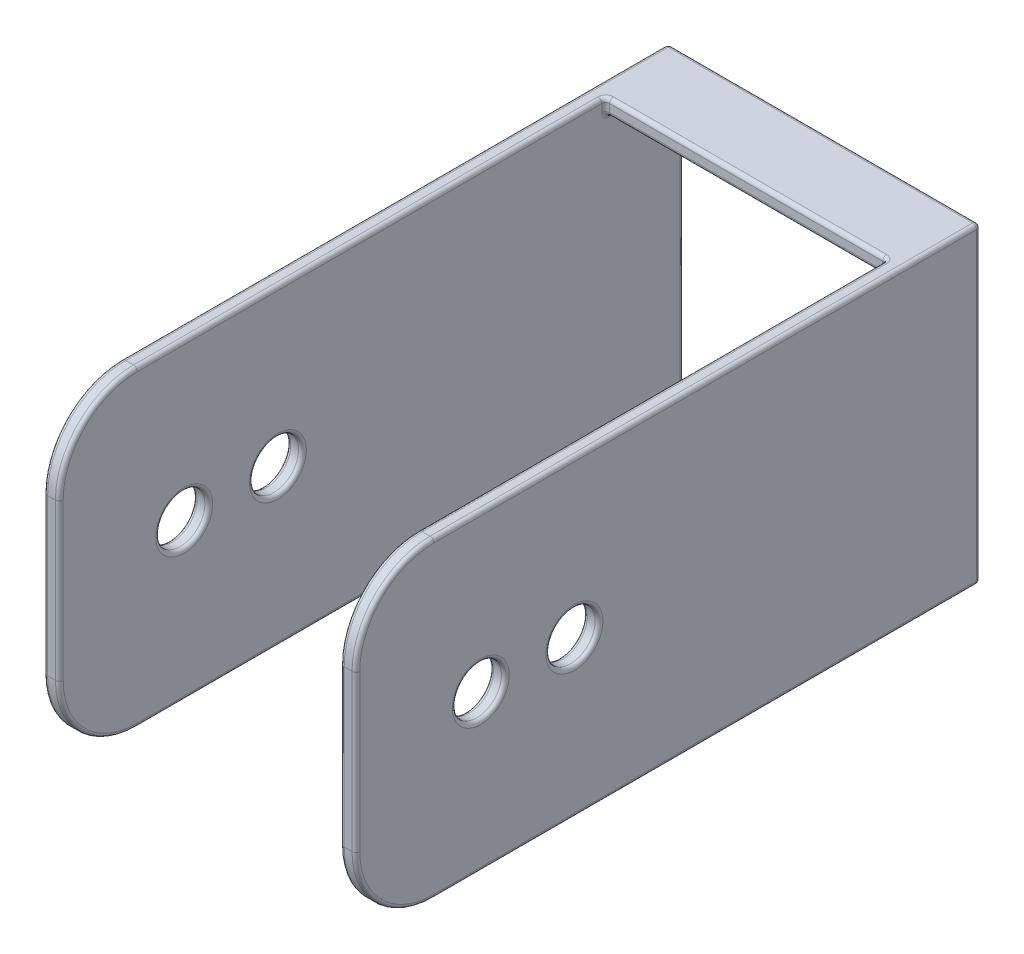
from build123d import *

# Parameters (mm, degrees)
SKIZZE1_W                       = 40
SKIZZE1_H                       = 40
SKIZZE1_W_2                     = 36
SKIZZE1_H_2                     = 36
AUFSATZ_LINEAR_AUSTRAGEN1_DEPTH = 80
SKIZZE2_W                       = 36
SKIZZE2_H                       = 70
SCHNITT_LINEAR_AUSTRAGEN1_DEPTH = 92.651513899
SKIZZE3_R                       = 3.15
SCHNITT_LINEAR_AUSTRAGEN2_DEPTH = 92.651513899
VERRUNDUNG1_R                   = 10
VERRUNDUNG2_R                   = 0.5


with BuildPart() as part:
    # Skizze1 → Aufsatz-Linear austragen1 (new body)
    with BuildSketch(Plane.XY):
        Rectangle(SKIZZE1_W, SKIZZE1_H)
        Rectangle(SKIZZE1_W_2, SKIZZE1_H_2, mode=Mode.SUBTRACT)
    extrude(amount=AUFSATZ_LINEAR_AUSTRAGEN1_DEPTH)

    # Skizze2 → Schnitt-Linear austragen1 (cut, through all)
    with BuildSketch(Plane(origin=(0, 20, 0), x_dir=(1, 0, 0), z_dir=(0, 1, 0))):
        with Locations((0, -45)):
            Rectangle(SKIZZE2_W, SKIZZE2_H)
    extrude(amount=-SCHNITT_LINEAR_AUSTRAGEN1_DEPTH, mode=Mode.SUBTRACT)

    # Skizze3 → Schnitt-Linear austragen2 (cut, through all)
    with BuildSketch(Plane(origin=(20, 0, 0), x_dir=(0, 0, -1), z_dir=(1, 0, 0))):
        with Locations((-64, 0)):
            Circle(SKIZZE3_R)
        with Locations((-52, 0)):
            Circle(SKIZZE3_R)
    extrude(amount=-SCHNITT_LINEAR_AUSTRAGEN2_DEPTH, mode=Mode.SUBTRACT)

    # Verrundung1
    verrundung1_edges = [part.edges().sort_by_distance(p)[0] for p in [
        (-19, -20, 80),
        (19, -20, 80),
        (-19, 20, 80),
        (19, 20, 80),
    ]]
    fillet(verrundung1_edges, radius=VERRUNDUNG1_R)

    # Verrundung2
    verrundung2_edges = [part.edges().sort_by_distance(p)[0] for p in [
        (18, 0, 0),
        (0, 18, 0),
        (-18, 0, 0),
        (0, -18, 0),
        (-18, -18, 5),
        (18, -18, 5),
        (0, -18, 10),
        (-18, 18, 5),
        (18, 18, 5),
        (0, 18, 10),
        (-18, 19, 10),
        (18, 19, 10),
        (-18, -20, 40),
        (0, -20, 10),
        (-18, -19, 10),
        (18, -19, 10),
        (-18, 20, 40),
        (0, 20, 10),
        (0, -20, 0),
        (-20, 0, 0),
        (0, 20, 0),
        (-18, 0, 67.15),
        (18, 0, 67.15),
        (-20, 0, 67.15),
        (20, 0, 67.15),
        (20, 0, 0),
        (-18, 0, 55.15),
        (18, 0, 55.15),
        (-20, 0, 55.15),
        (20, 0, 55.15),
        (-18, 0, 80),
        (-20, 0, 80),
        (-18, 17.071067812, 77.071067812),
        (-18, -17.071067812, 77.071067812),
        (-20, -20, 35),
        (20, -20, 35),
        (18, -20, 40),
        (-20, 20, 35),
        (-20, 17.071067812, 77.071067812),
        (-20, -17.071067812, 77.071067812),
        (18, 0, 80),
        (20, 0, 80),
        (20, 20, 35),
        (20, 17.071067812, 77.071067812),
        (20, -17.071067812, 77.071067812),
        (18, 20, 40),
        (18, 17.071067812, 77.071067812),
        (18, -17.071067812, 77.071067812),
    ]]
    fillet(verrundung2_edges, radius=VERRUNDUNG2_R)


solid = part.part
